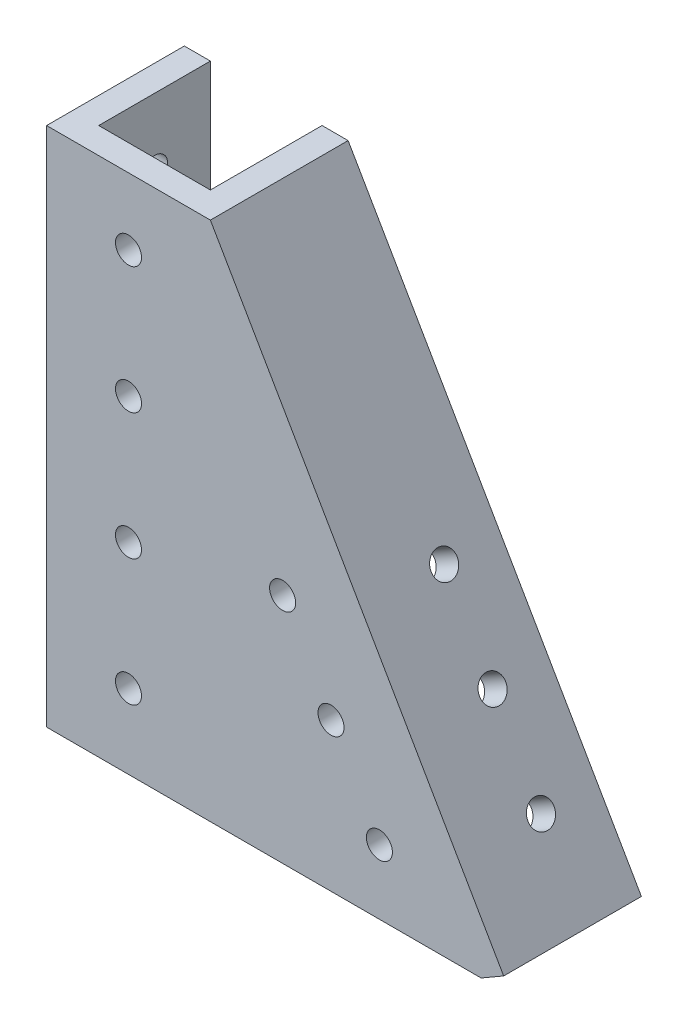
from build123d import *

# Parameters (mm, degrees)
BOSS_EXTRUDE1_DEPTH = 18.5
SKETCH2_W           = 15
SKETCH2_H           = 69.980762113
CUT_EXTRUDE1_DEPTH  = 15
SKETCH3_R           = 1.75
CUT_EXTRUDE2_DEPTH  = 3.5
SKETCH4_R           = 1.75
CUT_EXTRUDE3_DEPTH  = 4
SKETCH5_R           = 1.75
CUT_EXTRUDE4_DEPTH  = 4
CUT_EXTRUDE5_DEPTH  = 19


with BuildPart() as part:
    # Sketch1 → Boss-Extrude1 (new body)
    with BuildSketch(Plane.XY):
        Polygon((7.85498998, 37.469557102), (48.258401824, -32.511205011), (7.85498998, -32.511205011), (-14.14501002, -32.511205011), (-14.14501002, 37.469557102), align=None)
    extrude(amount=BOSS_EXTRUDE1_DEPTH)

    # Sketch2 → Cut-Extrude1 (cut)
    with BuildSketch(Plane.XY):
        with Locations((-3.14501002, 2.479176046)):
            Rectangle(SKETCH2_W, SKETCH2_H)
        Polygon((44.21694994, -32.511205011), (19.886822921, 9.62981114), (6.896441864, 2.12981114), (26.896441864, -32.511205011), align=None)
    extrude(amount=CUT_EXTRUDE1_DEPTH, mode=Mode.SUBTRACT)

    # Sketch3 → Cut-Extrude2 (cut)
    with BuildSketch(Plane(origin=(22.116036645, 12.76869971, 0), x_dir=(0, 0, -1), z_dir=(0.8660254037844378, 0.5000000000000016, 0))):
        with Locations(Location((-7.5, -38.284730359, 0), (0, 0, 90))):
            Circle(SKETCH3_R)
        with Locations(Location((-7.5, -25.284730359, 0), (0, 0, 90))):
            Circle(SKETCH3_R)
        with Locations(Location((-7.5, -12.284730359, 0), (0, 0, 90))):
            Circle(SKETCH3_R)
    extrude(amount=-CUT_EXTRUDE2_DEPTH, mode=Mode.SUBTRACT)

    # Sketch4 → Cut-Extrude3 (cut)
    with BuildSketch(Plane(origin=(0, 0, 18.5), x_dir=(-1, 0, 0), z_dir=(0, 0, -1))):
        with Locations(Location((-30.556695902, -23.850950973, 0), (0, 0, 180))):
            Circle(SKETCH4_R)
        with Locations(Location((-24.056695902, -12.592620724, 0), (0, 0, 180))):
            Circle(SKETCH4_R)
        with Locations(Location((-17.556695902, -1.334290475, 0), (0, 0, 180))):
            Circle(SKETCH4_R)
        with Locations(Location((3.14501002, -5.511205011, 0), (0, 0, 180))):
            Circle(SKETCH4_R)
        with Locations(Location((3.14501002, 11.488794989, 0), (0, 0, 180))):
            Circle(SKETCH4_R)
        with Locations(Location((3.14501002, 28.488794989, 0), (0, 0, 180))):
            Circle(SKETCH4_R)
        with Locations(Location((3.14501002, -22.511205011, 0), (0, 0, 180))):
            Circle(SKETCH4_R)
    extrude(amount=CUT_EXTRUDE3_DEPTH, mode=Mode.SUBTRACT)

    # Sketch5 → Cut-Extrude4 (cut)
    with BuildSketch(Plane.ZY.offset(14.14501002)):
        with Locations(Location((7.5, -22.511205011, 0), (0, 0, 270))):
            Circle(SKETCH5_R)
        with Locations(Location((7.5, -5.511205011, 0), (0, 0, 270))):
            Circle(SKETCH5_R)
        with Locations(Location((7.5, 11.488794989, 0), (0, 0, 270))):
            Circle(SKETCH5_R)
        with Locations(Location((7.5, 28.488794989, 0), (0, 0, 270))):
            Circle(SKETCH5_R)
    extrude(amount=-CUT_EXTRUDE4_DEPTH, mode=Mode.SUBTRACT)

    # Sketch6 → Cut-Extrude5 (cut)
    with BuildSketch(Plane.XY.offset(18.5)):
        Polygon((44.21694994, -32.511205011), (47.248038853, -30.761205011), (48.258401824, -32.511205011), align=None)
    extrude(amount=-CUT_EXTRUDE5_DEPTH, mode=Mode.SUBTRACT)


solid = part.part
